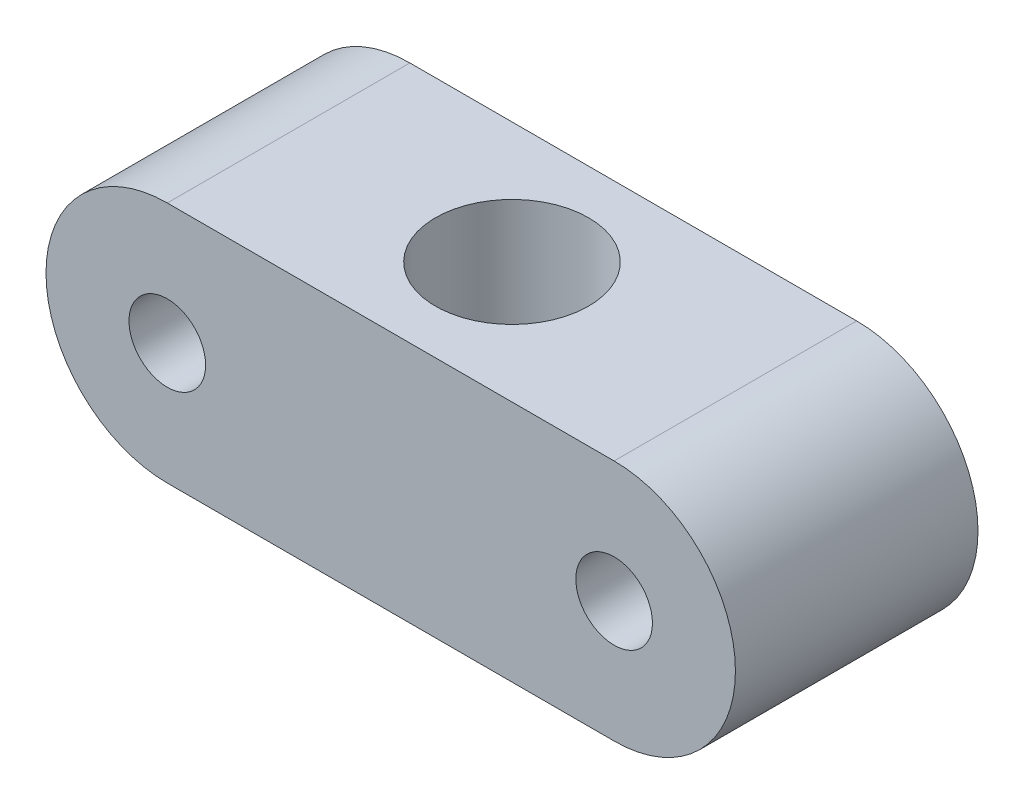
from build123d import *

# Parameters (mm, degrees)
SKETCH1_R           = 6
BOSS_EXTRUDE1_DEPTH = 19
SKETCH2_R           = 12
CUT_EXTRUDE1_DEPTH  = 99.620484688


with BuildPart() as part:
    # Sketch1 → Boss-Extrude1 (new, symmetric)
    with BuildSketch(Plane.XY):
        with BuildLine():
            Line((0, 19), (70, 19))
            ThreePointArc((70, 19), (89, 0), (70, -19))
            Line((70, -19), (0, -19))
            ThreePointArc((0, -19), (-19, 0), (0, 19))
        make_face()
        Circle(SKETCH1_R, mode=Mode.SUBTRACT)
        with Locations((70, 0)):
            Circle(SKETCH1_R, mode=Mode.SUBTRACT)
    extrude(amount=BOSS_EXTRUDE1_DEPTH, both=True)

    # Sketch2 → Cut-Extrude1 (cut, through all)
    with BuildSketch(Plane.XZ.offset(19)):
        with Locations(Location((35, 0, 0), (0, 0, 270))):
            Circle(SKETCH2_R)
    extrude(amount=-CUT_EXTRUDE1_DEPTH, mode=Mode.SUBTRACT)


solid = part.part
